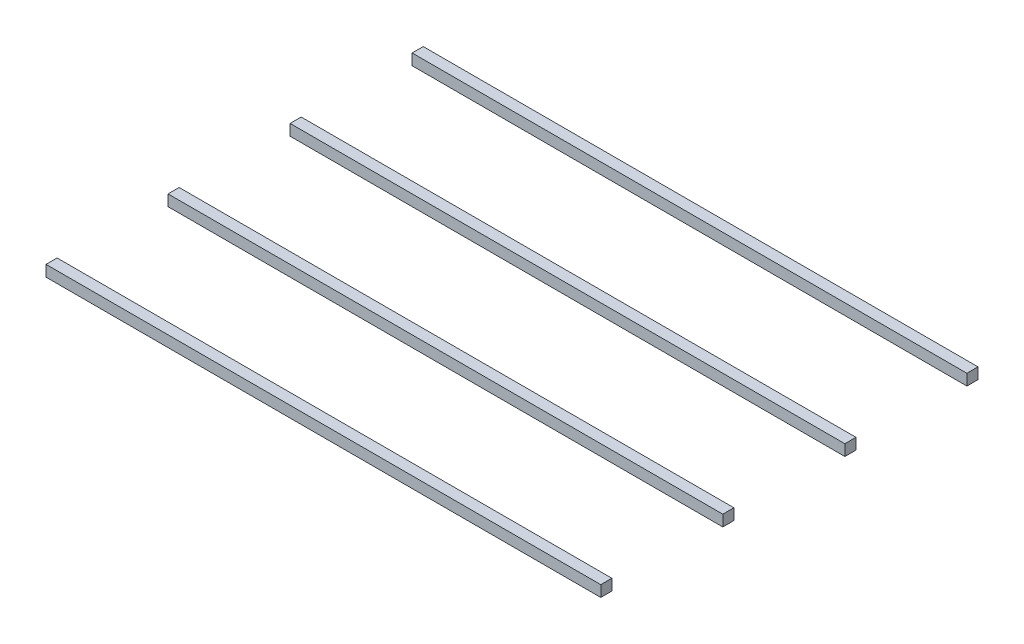
from build123d import *

# Parameters (mm, degrees)
SKETCH1_W             = 50
SKETCH1_H             = 1
BOSS_EXTRUDE1_DEPTH   = 1
BOSS_EXTRUDE1_2_DEPTH = 1
BOSS_EXTRUDE1_3_DEPTH = 1
BOSS_EXTRUDE1_4_DEPTH = 1


with BuildPart() as part:
    # Sketch1 → Boss-Extrude1 (new body)
    with BuildSketch(Plane(origin=(0, 0, 0), x_dir=(1, 0, 0), z_dir=(0, 1, 0))):
        with Locations((0.468331847, 5.977736756)):
            Rectangle(SKETCH1_W, SKETCH1_H)
    extrude(amount=BOSS_EXTRUDE1_DEPTH)


with BuildPart() as body_2:
    # Sketch1 → Boss-Extrude1 2 (new body)
    with BuildSketch(Plane(origin=(0, 0, 0), x_dir=(1, 0, 0), z_dir=(0, 1, 0))):
        with Locations((0.468331847, -5.022263244)):
            Rectangle(SKETCH1_W, SKETCH1_H)
    extrude(amount=BOSS_EXTRUDE1_2_DEPTH)


with BuildPart() as body_3:
    # Sketch1 → Boss-Extrude1 3 (new body)
    with BuildSketch(Plane(origin=(0, 0, 0), x_dir=(1, 0, 0), z_dir=(0, 1, 0))):
        with Locations((0.468331847, -16.022263244)):
            Rectangle(SKETCH1_W, SKETCH1_H)
    extrude(amount=BOSS_EXTRUDE1_3_DEPTH)


with BuildPart() as body_4:
    # Sketch1 → Boss-Extrude1 4 (new body)
    with BuildSketch(Plane(origin=(0, 0, 0), x_dir=(1, 0, 0), z_dir=(0, 1, 0))):
        with Locations((0.468331847, -27.022263244)):
            Rectangle(SKETCH1_W, SKETCH1_H)
    extrude(amount=BOSS_EXTRUDE1_4_DEPTH)


solid = Compound([part.part, body_2.part, body_3.part, body_4.part])
